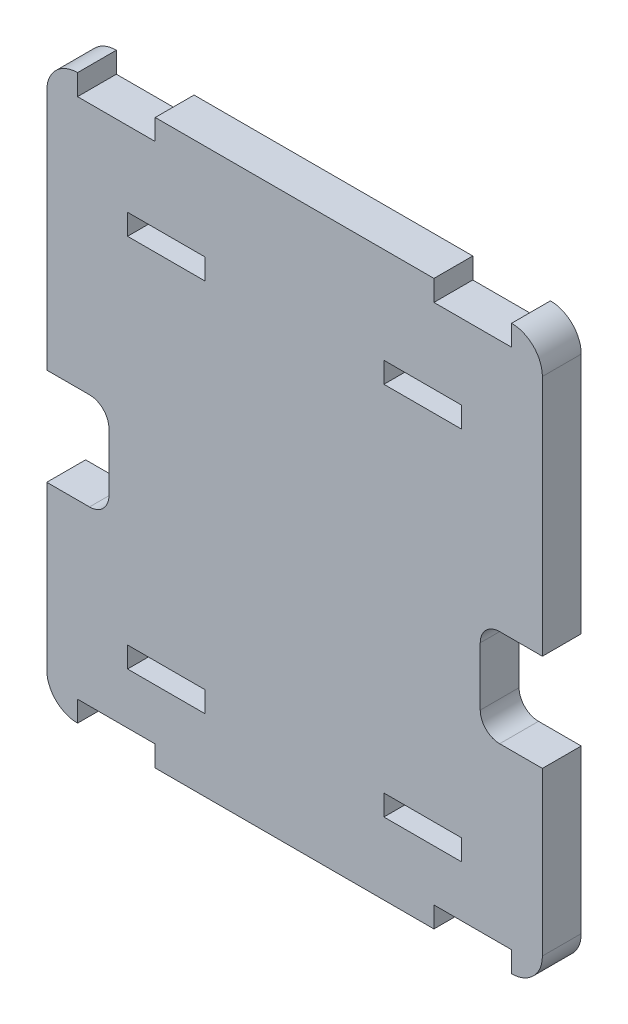
from build123d import *

# Parameters (mm, degrees)
SKETCH1_W           = 12.7
SKETCH1_H           = 3.4036
BOSS_EXTRUDE1_DEPTH = 6.35


with BuildPart() as part:
    # Sketch1 → Boss-Extrude1 (new body)
    with BuildSketch(Plane.XY):
        with BuildLine():
            Line((8603.455921527, 2991.548549024), (8603.455921527, 2951.939177286))
            Line((8603.455921527, 2951.939177286), (8610.440921527, 2951.939177286))
            ThreePointArc((8610.440921527, 2951.939177286), (8612.685985557, 2951.009241316), (8613.615921527, 2948.764177286))
            Line((8613.615921527, 2948.764177286), (8613.615921527, 2939.239177286))
            ThreePointArc((8613.615921527, 2939.239177286), (8612.685985557, 2936.994113255), (8610.440921527, 2936.064177286))
            Line((8610.440921527, 2936.064177286), (8603.455921527, 2936.064177286))
            Line((8603.455921527, 2936.064177286), (8603.455921527, 2909.495777286))
            ThreePointArc((8603.455921527, 2909.495777286), (8604.928940103, 2905.939595862), (8608.485121527, 2904.466577286))
            Line((8608.485121527, 2904.466577286), (8608.485121527, 2907.870177286))
            Line((8608.485121527, 2907.870177286), (8621.185121527, 2907.870177286))
            Line((8621.185121527, 2907.870177286), (8621.185121527, 2904.466577286))
            Line((8621.185121527, 2904.466577286), (8666.752721527, 2904.466577286))
            Line((8666.752721527, 2904.466577286), (8666.752721527, 2907.870177286))
            Line((8666.752721527, 2907.870177286), (8679.452721527, 2907.870177286))
            Line((8679.452721527, 2907.870177286), (8679.452721527, 2904.466577286))
            ThreePointArc((8679.452721527, 2904.466577286), (8683.008902951, 2905.939595862), (8684.481921527, 2909.495777286))
            Line((8684.481921527, 2909.495777286), (8684.481921527, 2936.064177286))
            Line((8684.481921527, 2936.064177286), (8677.496921527, 2936.064177286))
            ThreePointArc((8677.496921527, 2936.064177286), (8675.251857497, 2936.994113255), (8674.321921527, 2939.239177286))
            Line((8674.321921527, 2939.239177286), (8674.321921527, 2948.764177286))
            ThreePointArc((8674.321921527, 2948.764177286), (8675.251857497, 2951.009241316), (8677.496921527, 2951.939177286))
            Line((8677.496921527, 2951.939177286), (8684.481921527, 2951.939177286))
            Line((8684.481921527, 2951.939177286), (8684.481921527, 2991.548549024))
            ThreePointArc((8684.481921527, 2991.548549024), (8683.008902951, 2995.104730448), (8679.452721527, 2996.577749024))
            Line((8679.452721527, 2996.577749024), (8679.452721527, 2993.174149024))
            Line((8679.452721527, 2993.174149024), (8666.752721527, 2993.174149024))
            Line((8666.752721527, 2993.174149024), (8666.752721527, 2996.577749024))
            Line((8666.752721527, 2996.577749024), (8621.185121527, 2996.577749024))
            Line((8621.185121527, 2996.577749024), (8621.185121527, 2993.174149024))
            Line((8621.185121527, 2993.174149024), (8608.485121527, 2993.174149024))
            Line((8608.485121527, 2993.174149024), (8608.485121527, 2996.577749024))
            ThreePointArc((8608.485121527, 2996.577749024), (8604.928940103, 2995.104730448), (8603.455921527, 2991.548549024))
        make_face()
        with Locations((8623.013921527, 2917.928577286)):
            Rectangle(SKETCH1_W, SKETCH1_H, mode=Mode.SUBTRACT)
        with Locations((8664.923921527, 2917.928577286)):
            Rectangle(SKETCH1_W, SKETCH1_H, mode=Mode.SUBTRACT)
        with Locations((8664.923921527, 2979.193377286)):
            Rectangle(SKETCH1_W, SKETCH1_H, mode=Mode.SUBTRACT)
        with Locations((8623.013921527, 2979.193377286)):
            Rectangle(SKETCH1_W, SKETCH1_H, mode=Mode.SUBTRACT)
    extrude(amount=BOSS_EXTRUDE1_DEPTH)


solid = part.part
